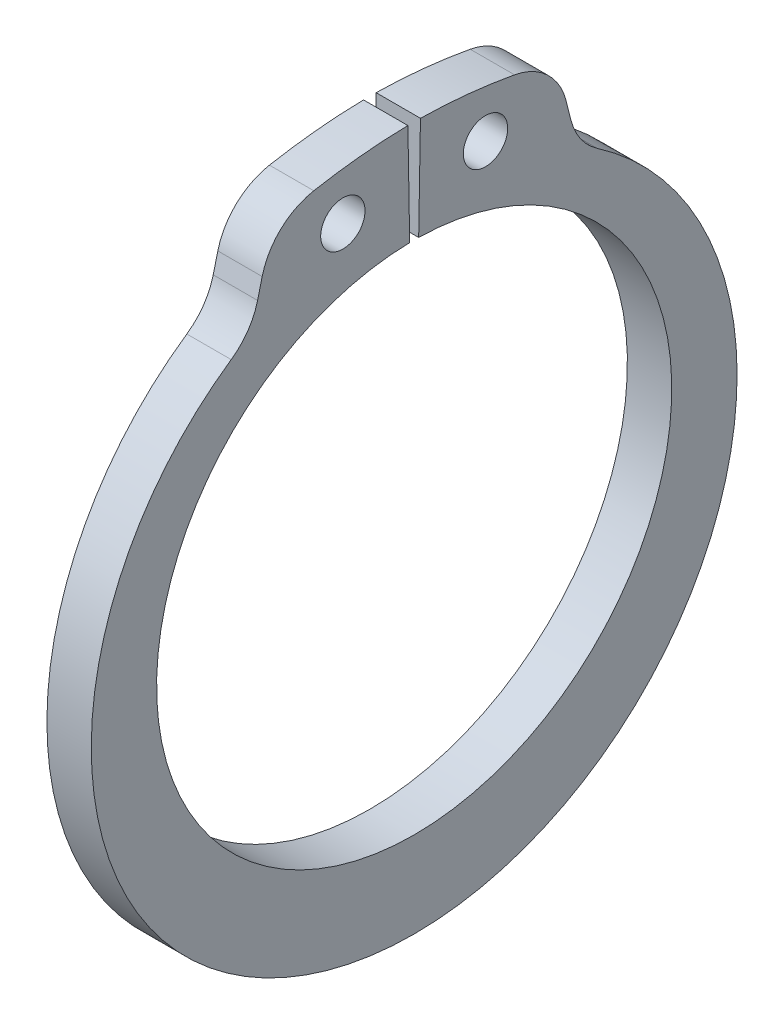
from build123d import *

# Parameters (mm, degrees)
SKETCH1_R      = 0.9906
EXTRUDE1_DEPTH = 0.9906
FILLET1_R      = 2.921


with BuildPart() as part:
    # Sketch1 → Extrude1 (new, symmetric)
    with BuildSketch(Plane(origin=(0, 0, 0), x_dir=(0, 0, -1), z_dir=(1, 0, 0))):
        with BuildLine():
            Line((-0.200810879, 11.50444755), (-0.280603281, 16.075751212))
            ThreePointArc((-0.280603281, 16.075751212), (-3.342127668, 15.838850739), (-6.35354883, 15.238520836))
            Line((-6.35354883, 15.238520836), (-7.276503528, 11.536751728))
            ThreePointArc((-7.276503528, 11.536751728), (0, -15.3416), (7.276503528, 11.536751728))
            Line((7.276503528, 11.536751728), (6.35354883, 15.238520836))
            ThreePointArc((6.35354883, 15.238520836), (3.342127668, 15.838850739), (0.280603281, 16.075751212))
            Line((0.280603281, 16.075751212), (0.200810879, 11.50444755))
            ThreePointArc((0.200810879, 11.50444755), (0, -11.5062), (-0.200810879, 11.50444755))
        make_face()
        with Locations((-3.18562375, 13.738695669)):
            Circle(SKETCH1_R, mode=Mode.SUBTRACT)
        with Locations((3.18562375, 13.738695669)):
            Circle(SKETCH1_R, mode=Mode.SUBTRACT)
    extrude(amount=EXTRUDE1_DEPTH, both=True)

    # Fillet1
    fillet1_edges = [part.edges().sort_by_distance(p)[0] for p in [
        (0, 15.238520836, -6.35354883),
        (0, 11.536751728, -7.276503528),
        (0, 11.536751728, 7.276503528),
        (0, 15.238520836, 6.35354883),
    ]]
    fillet(fillet1_edges, radius=FILLET1_R)


solid = part.part
